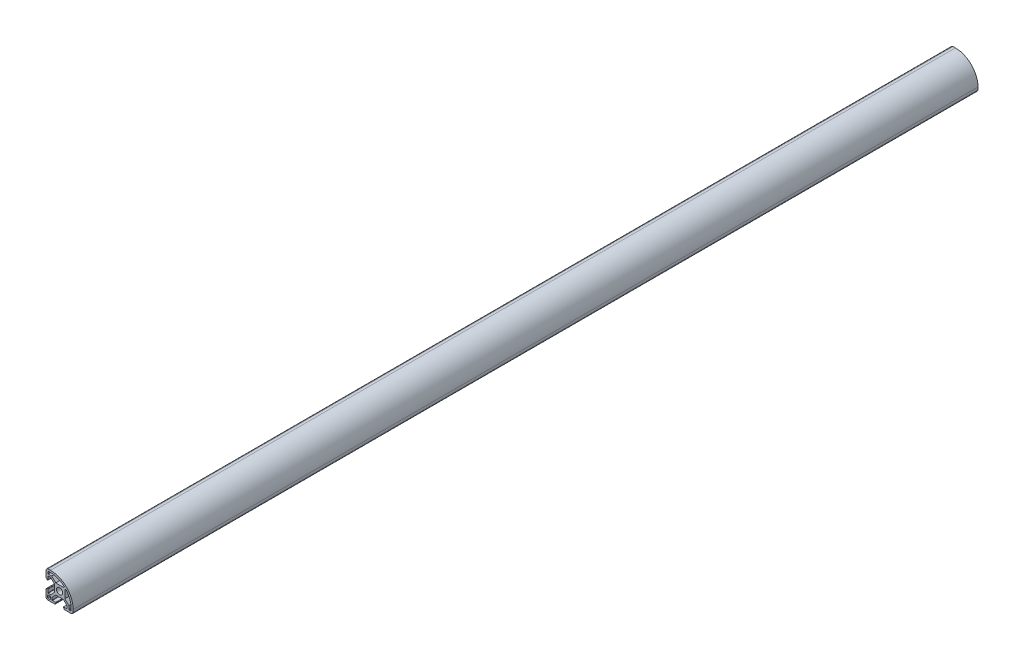
from build123d import *

# Parameters (mm, degrees)
SKETCH_1_R      = 3.4
EXTRUDE_1_DEPTH = 1000


with BuildPart() as part:
    # 草图1 → 凸台-拉伸1 (new body)
    with BuildSketch(Plane.XY):
        with BuildLine():
            Line((-29.957449905, -7.030330124), (-29.957449905, -14.430330124))
            ThreePointArc((-29.957449905, -14.430330124), (-29.225216858, -16.198097077), (-27.457449905, -16.930330124))
            Line((-27.457449905, -16.930330124), (-20.057449905, -16.930330124))
            Line((-20.057449905, -16.930330124), (-20.057449905, -16.130330124))
            ThreePointArc((-20.057449905, -16.130330124), (-19.998871261, -15.988908768), (-19.857449905, -15.930330124))
            Line((-19.857449905, -15.930330124), (-19.057449905, -15.930330124))
            Line((-19.057449905, -15.930330124), (-19.057449905, -15.030330124))
            ThreePointArc((-19.057449905, -15.030330124), (-19.145317871, -14.818198089), (-19.357449905, -14.730330124))
            Line((-19.357449905, -14.730330124), (-22.907449905, -14.730330124))
            ThreePointArc((-22.907449905, -14.730330124), (-23.11958194, -14.642462158), (-23.207449905, -14.430330124))
            Line((-23.207449905, -14.430330124), (-23.207449905, -11.735965042))
            Line((-23.207449905, -11.735965042), (-19.201814987, -7.730330124))
            Line((-19.201814987, -7.730330124), (-10.713084824, -7.730330124))
            Line((-10.713084824, -7.730330124), (-6.707449905, -11.735965042))
            Line((-6.707449905, -11.735965042), (-6.707449905, -14.430330124))
            ThreePointArc((-6.707449905, -14.430330124), (-6.795317871, -14.642462158), (-7.007449905, -14.730330124))
            Line((-7.007449905, -14.730330124), (-10.557449905, -14.730330124))
            ThreePointArc((-10.557449905, -14.730330124), (-10.76958194, -14.818198089), (-10.857449905, -15.030330124))
            Line((-10.857449905, -15.030330124), (-10.857449905, -15.930330124))
            Line((-10.857449905, -15.930330124), (-10.057449905, -15.930330124))
            ThreePointArc((-10.057449905, -15.930330124), (-9.916028549, -15.988908768), (-9.857449905, -16.130330124))
            Line((-9.857449905, -16.130330124), (-9.857449905, -16.930330124))
            Line((-9.857449905, -16.930330124), (-2.457449905, -16.930330124))
            ThreePointArc((-2.457449905, -16.930330124), (-0.689682952, -16.198097077), (0.042550095, -14.430330124))
            Line((0.042550095, -14.430330124), (0.042550095, -11.930330124))
            ThreePointArc((0.042550095, -11.930330124), (-7.279780376, 5.747339406), (-24.957449905, 13.069669876))
            Line((-24.957449905, 13.069669876), (-27.457449905, 13.069669876))
            ThreePointArc((-27.457449905, 13.069669876), (-29.225216858, 12.337436829), (-29.957449905, 10.569669876))
            Line((-29.957449905, 10.569669876), (-29.957449905, 3.169669876))
            Line((-29.957449905, 3.169669876), (-29.157449905, 3.169669876))
            ThreePointArc((-29.157449905, 3.169669876), (-29.016028549, 3.111091232), (-28.957449905, 2.969669876))
            Line((-28.957449905, 2.969669876), (-28.957449905, 2.169669876))
            Line((-28.957449905, 2.169669876), (-28.057449905, 2.169669876))
            ThreePointArc((-28.057449905, 2.169669876), (-27.845317871, 2.257537842), (-27.757449905, 2.469669876))
            Line((-27.757449905, 2.469669876), (-27.757449905, 6.019669876))
            ThreePointArc((-27.757449905, 6.019669876), (-27.66958194, 6.231801911), (-27.457449905, 6.319669876))
            Line((-27.457449905, 6.319669876), (-24.763084824, 6.319669876))
            Line((-24.763084824, 6.319669876), (-20.757449905, 2.314034958))
            Line((-20.757449905, 2.314034958), (-20.757449905, -6.174695205))
            Line((-20.757449905, -6.174695205), (-24.763084824, -10.180330124))
            Line((-24.763084824, -10.180330124), (-27.457449905, -10.180330124))
            ThreePointArc((-27.457449905, -10.180330124), (-27.66958194, -10.092462158), (-27.757449905, -9.880330124))
            Line((-27.757449905, -9.880330124), (-27.757449905, -6.330330124))
            ThreePointArc((-27.757449905, -6.330330124), (-27.845317871, -6.118198089), (-28.057449905, -6.030330124))
            Line((-28.057449905, -6.030330124), (-28.957449905, -6.030330124))
            Line((-28.957449905, -6.030330124), (-28.957449905, -6.830330124))
            ThreePointArc((-28.957449905, -6.830330124), (-29.016028549, -6.97175148), (-29.157449905, -7.030330124))
            Line((-29.157449905, -7.030330124), (-29.957449905, -7.030330124))
        make_face()
        with Locations((-14.957449905, -1.930330124)):
            Circle(SKETCH_1_R, mode=Mode.SUBTRACT)
        with BuildLine():
            Line((-9.632006825, 4.950747875), (-10.713084824, 3.869669876))
            Line((-10.713084824, 3.869669876), (-19.201814987, 3.869669876))
            Line((-19.201814987, 3.869669876), (-23.651814987, 8.319669876))
            Line((-23.651814987, 8.319669876), (-27.457449905, 8.319669876))
            ThreePointArc((-27.457449905, 8.319669876), (-27.66958194, 8.407537842), (-27.757449905, 8.619669876))
            Line((-27.757449905, 8.619669876), (-27.757449905, 10.569669876))
            ThreePointArc((-27.757449905, 10.569669876), (-27.66958194, 10.781801911), (-27.457449905, 10.869669876))
            Line((-27.457449905, 10.869669876), (-24.957449905, 10.869669876))
            ThreePointArc((-24.957449905, 10.869669876), (-16.743089868, 9.338527137), (-9.632006825, 4.950747875))
        make_face(mode=Mode.SUBTRACT)
        with BuildLine():
            Line((-27.932449905, -15.205330124), (-25.232449905, -15.205330124))
            ThreePointArc((-25.232449905, -15.205330124), (-25.020317871, -15.117462158), (-24.932449905, -14.905330124))
            Line((-24.932449905, -14.905330124), (-24.932449905, -12.205330124))
            ThreePointArc((-24.932449905, -12.205330124), (-25.020317871, -11.993198089), (-25.232449905, -11.905330124))
            Line((-25.232449905, -11.905330124), (-27.932449905, -11.905330124))
            ThreePointArc((-27.932449905, -11.905330124), (-28.14458194, -11.993198089), (-28.232449905, -12.205330124))
            Line((-28.232449905, -12.205330124), (-28.232449905, -14.905330124))
            ThreePointArc((-28.232449905, -14.905330124), (-28.14458194, -15.117462158), (-27.932449905, -15.205330124))
        make_face(mode=Mode.SUBTRACT)
        with BuildLine():
            Line((-8.076371906, 3.395112956), (-9.157449905, 2.314034958))
            Line((-9.157449905, 2.314034958), (-9.157449905, -6.174695205))
            Line((-9.157449905, -6.174695205), (-4.707449905, -10.624695205))
            Line((-4.707449905, -10.624695205), (-4.707449905, -14.430330124))
            ThreePointArc((-4.707449905, -14.430330124), (-4.61958194, -14.642462158), (-4.407449905, -14.730330124))
            Line((-4.407449905, -14.730330124), (-2.457449905, -14.730330124))
            ThreePointArc((-2.457449905, -14.730330124), (-2.245317871, -14.642462158), (-2.157449905, -14.430330124))
            Line((-2.157449905, -14.430330124), (-2.157449905, -11.930330124))
            ThreePointArc((-2.157449905, -11.930330124), (-3.688592644, -3.715970087), (-8.076371906, 3.395112956))
        make_face(mode=Mode.SUBTRACT)
    extrude(amount=EXTRUDE_1_DEPTH)


solid = part.part
